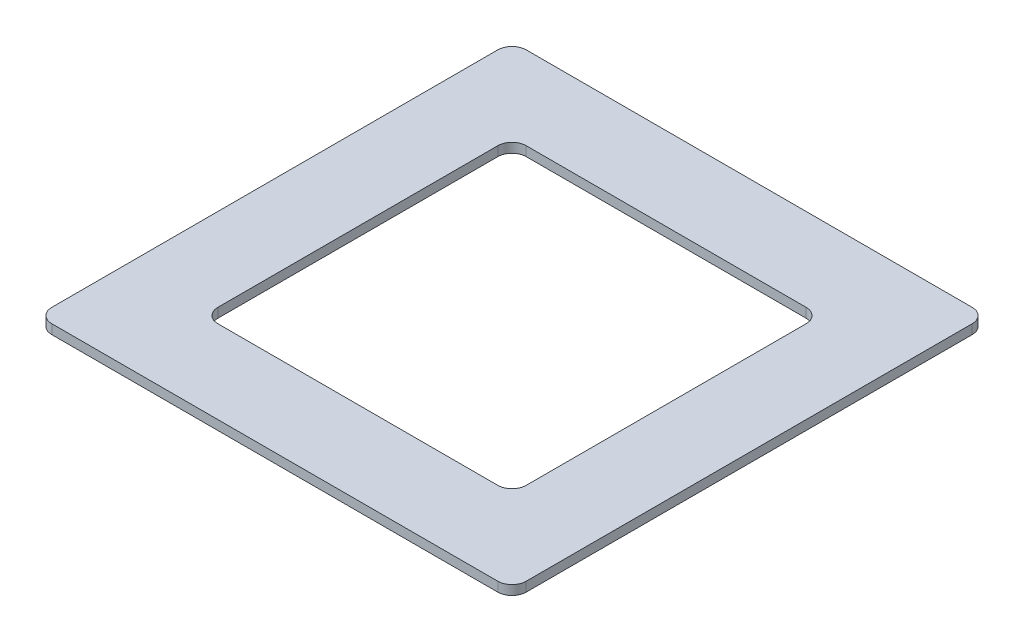
from build123d import *

# Parameters (mm, degrees)
EXTRUDE_1_DEPTH = 2


with BuildPart() as part:
    # 草图1 → 凸台-拉伸1 (new body)
    with BuildSketch(Plane(origin=(0, 0, 0), x_dir=(1, 0, 0), z_dir=(0, 1, 0))):
        with BuildLine():
            Line((3, 0), (97, 0))
            ThreePointArc((97, 0), (99.121320344, -0.878679656), (100, -3))
            Line((100, -3), (100, -97))
            ThreePointArc((100, -97), (99.121320344, -99.121320344), (97, -100))
            Line((97, -100), (3, -100))
            ThreePointArc((3, -100), (0.878679656, -99.121320344), (0, -97))
            Line((0, -97), (0, -3))
            ThreePointArc((0, -3), (0.878679656, -0.878679656), (3, 0))
        make_face()
        with BuildLine():
            Line((20.5, -17.5), (79.5, -17.5))
            ThreePointArc((79.5, -17.5), (81.621320344, -18.378679656), (82.5, -20.5))
            Line((82.5, -20.5), (82.5, -79.5))
            ThreePointArc((82.5, -79.5), (81.621320344, -81.621320344), (79.5, -82.5))
            Line((79.5, -82.5), (20.5, -82.5))
            ThreePointArc((20.5, -82.5), (18.378679656, -81.621320344), (17.5, -79.5))
            Line((17.5, -79.5), (17.5, -20.5))
            ThreePointArc((17.5, -20.5), (18.378679656, -18.378679656), (20.5, -17.5))
        make_face(mode=Mode.SUBTRACT)
    extrude(amount=EXTRUDE_1_DEPTH)


solid = part.part
